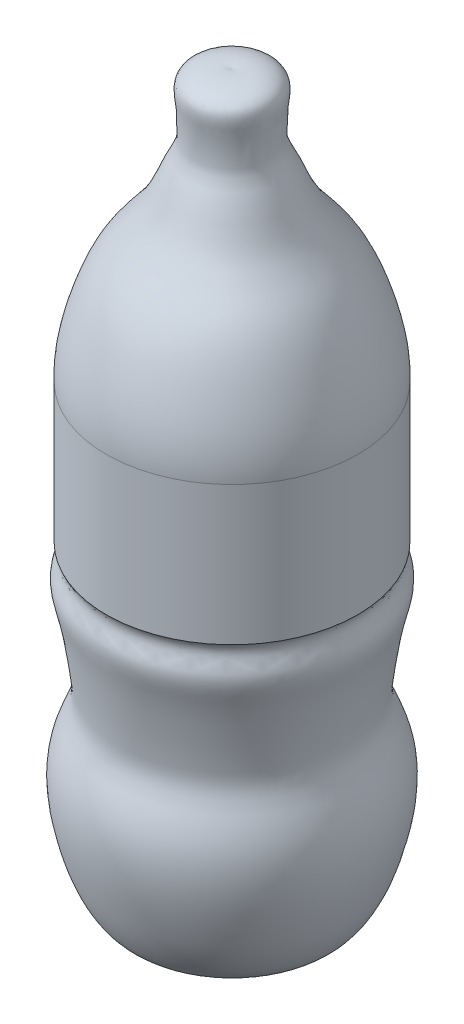
from build123d import *


with BuildPart() as part:
    # Croquis3 → Revolución1 (revolve)
    with BuildSketch(Plane.XY, mode=Mode.PRIVATE) as revoluci_n1_sk:
        with BuildLine():
            Line((301.028778623, 132.761412627), (301.028778623, 189.329901696))
            add(Edge.make_bspline(
                [(301.028778623, 189.329901696), (301.414869757, 198.520346087), (297.733562203, 214.698648815), (289.26591592, 235.885286327), (275.304038077, 249.885852761), (270.781218661, 264.239029999), (265.017936322, 274.232918872), (265.784738776, 279.920839545), (265.776841786, 283.339110648), (265.619684046, 287.899312184), (269.453066609, 299.95951829), (253.619368085, 300.909472287), (249.75057462, 300)],
                knots=[0, 0, 0, 0, 0.208383949, 0.372389271, 0.512162523, 0.645579084, 0.712485928, 0.765289156, 0.771501301, 0.790137734, 0.870895613, 1, 1, 1, 1], degree=3))
            Line((249.75057462, 300), (249.75057462, 0))
            add(Edge.make_bspline(
                [(249.75057462, 0), (258.768179522, -7.729137597), (260.413024151, 11.521326456), (271.532024429, 5.49233823), (277.391679076, 4.160587573), (287.128900424, 3.429810196), (294.804967365, 13.979569921), (301.293605014, 32.24139465), (305.063456401, 52.720547264), (299.523184654, 69.015493041), (295.106882961, 78.164918416), (297.161339683, 93.152880093), (299.072768518, 107.365279963), (303.728431903, 122.67112877), (298.456169405, 129.088087739), (301.028778623, 132.761412627)],
                knots=[0, 0, 0, 0, 0.111971148, 0.13207398, 0.195426633, 0.221308077, 0.292867474, 0.386805184, 0.571065702, 0.625385659, 0.682681507, 0.741550008, 0.877711211, 0.939291411, 1, 1, 1, 1], degree=3))
        make_face()
    revolve(revoluci_n1_sk.sketch.rotate(Axis((249.75057462, 4.047604165, 0), (0, 1, 0)), 90), axis=Axis((249.75057462, 4.047604165, 0), (0, 1, 0)))


solid = part.part
